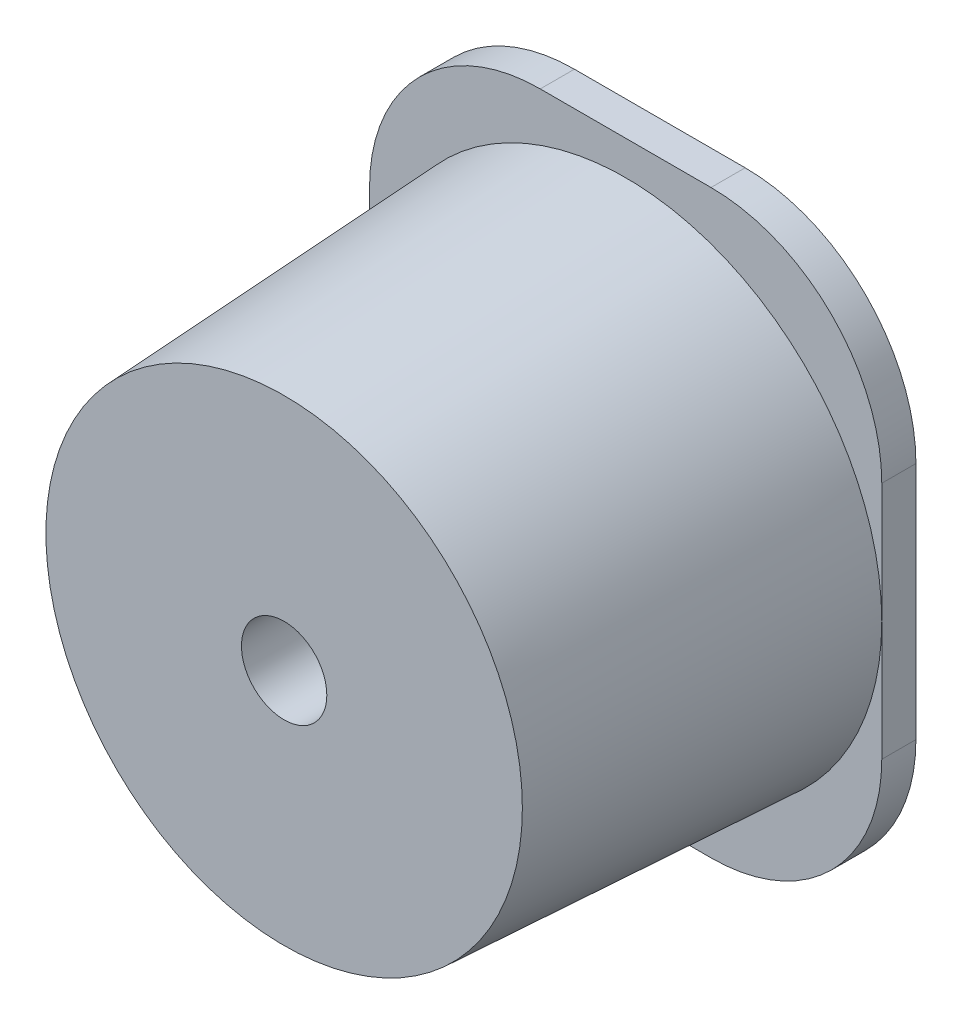
from build123d import *

# Parameters (mm, degrees)
SKETCH1_R           = 75
BOSS_EXTRUDE1_DEPTH = 100
BOSS_EXTRUDE1_TAPER = 3
BOSS_EXTRUDE2_DEPTH = 10
SKETCH3_R           = 12.5
CUT_EXTRUDE1_DEPTH  = 50


with BuildPart() as part:
    # Sketch1 → Boss-Extrude1 (new body)
    with BuildSketch(Plane.XY):
        Circle(SKETCH1_R)
    extrude(amount=BOSS_EXTRUDE1_DEPTH, taper=BOSS_EXTRUDE1_TAPER)

    # Sketch2 → Boss-Extrude2 (add)
    with BuildSketch(Plane(origin=(0, 0, 0), x_dir=(-1, 0, 0), z_dir=(0, 0, -1))):
        with BuildLine():
            Line((-25, -85), (25, -85))
            ThreePointArc((25, -85), (60.355339059, -70.355339059), (75, -35))
            Line((75, -35), (75, 35))
            ThreePointArc((75, 35), (60.355339059, 70.355339059), (25, 85))
            Line((25, 85), (-25, 85))
            ThreePointArc((-25, 85), (-60.355339059, 70.355339059), (-75, 35))
            Line((-75, 35), (-75, -35))
            ThreePointArc((-75, -35), (-60.355339059, -70.355339059), (-25, -85))
        make_face()
    extrude(amount=BOSS_EXTRUDE2_DEPTH)

    # Sketch3 → Cut-Extrude1 (cut)
    with BuildSketch(Plane.XY.offset(100)):
        Circle(SKETCH3_R)
    extrude(amount=-CUT_EXTRUDE1_DEPTH, mode=Mode.SUBTRACT)


solid = part.part
